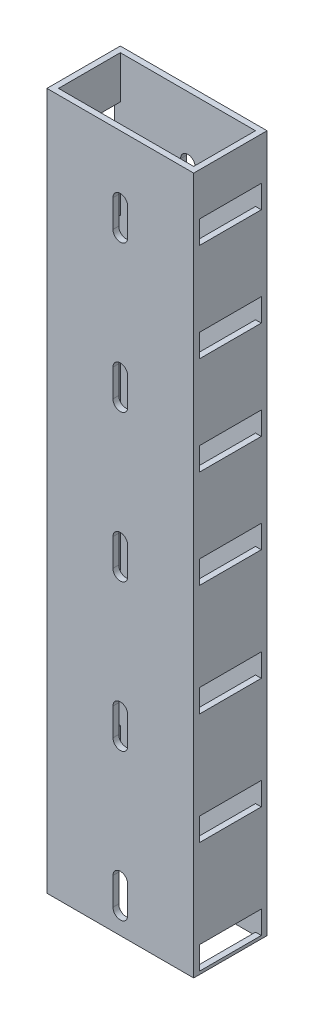
from build123d import *

# Parameters (mm, degrees)
SKETCH1_W           = 50.8
SKETCH1_H           = 25.4
SKETCH1_W_2         = 46.8
SKETCH1_H_2         = 21.4
BOSS_EXTRUDE1_DEPTH = 241.3
SKETCH2_W           = 21.4
SKETCH2_H           = 7.9375
CUT_EXTRUDE1_DEPTH  = 248.894110458
LPATTERN1_COUNT     = 4
LPATTERN1_PITCH     = 33.9725
LPATTERN1_COL_COUNT = 4
LPATTERN1_COL_PITCH = 38.5445
CUT_EXTRUDE2_DEPTH  = 248.894110458
LPATTERN2_COUNT     = 5
LPATTERN2_PITCH     = 50.8


with BuildPart() as part:
    # Sketch1 → Boss-Extrude1 (new body)
    with BuildSketch(Plane(origin=(0, 0, 0), x_dir=(1, 0, 0), z_dir=(0, 1, 0))):
        with Locations((25.4, 12.7)):
            Rectangle(SKETCH1_W, SKETCH1_H)
        with Locations((25.4, 12.7)):
            Rectangle(SKETCH1_W_2, SKETCH1_H_2, mode=Mode.SUBTRACT)
    extrude(amount=-BOSS_EXTRUDE1_DEPTH)

    # Sketch2 → Cut-Extrude1 (cut, through all)
    with BuildSketch(Plane(origin=(50.8, 0, 0), x_dir=(0, 0, -1), z_dir=(1, 0, 0))):
        with Locations((12.7, -120.65)):
            Rectangle(SKETCH2_W, SKETCH2_H)
    cut_extrude1 = extrude(amount=-CUT_EXTRUDE1_DEPTH, mode=Mode.SUBTRACT)

    # LPattern1: Cut-Extrude1 ×4
    with Locations(*[(0, i * LPATTERN1_PITCH, 0) for i in range(1, LPATTERN1_COUNT)]):
        add(cut_extrude1, mode=Mode.SUBTRACT)

    # LPattern1 col: Cut-Extrude1 ×4
    with Locations(*[(0, -i * LPATTERN1_COL_PITCH, 0) for i in range(1, LPATTERN1_COL_COUNT)]):
        add(cut_extrude1, mode=Mode.SUBTRACT)

    # Sketch3 → Cut-Extrude2 (cut, through all)
    with BuildSketch(Plane(origin=(0, 0, -25.4), x_dir=(-1, 0, 0), z_dir=(0, 0, -1))):
        with BuildLine():
            Line((-22.86, -21.336), (-22.86, -30.861))
            ThreePointArc((-22.86, -30.861), (-25.4, -33.401), (-27.94, -30.861))
            Line((-27.94, -30.861), (-27.94, -21.336))
            ThreePointArc((-27.94, -21.336), (-25.4, -18.796), (-22.86, -21.336))
        make_face()
    cut_extrude2 = extrude(amount=-CUT_EXTRUDE2_DEPTH, mode=Mode.SUBTRACT)

    # LPattern2: Cut-Extrude2 ×5
    with Locations(*[(0, -i * LPATTERN2_PITCH, 0) for i in range(1, LPATTERN2_COUNT)]):
        add(cut_extrude2, mode=Mode.SUBTRACT)


solid = part.part
